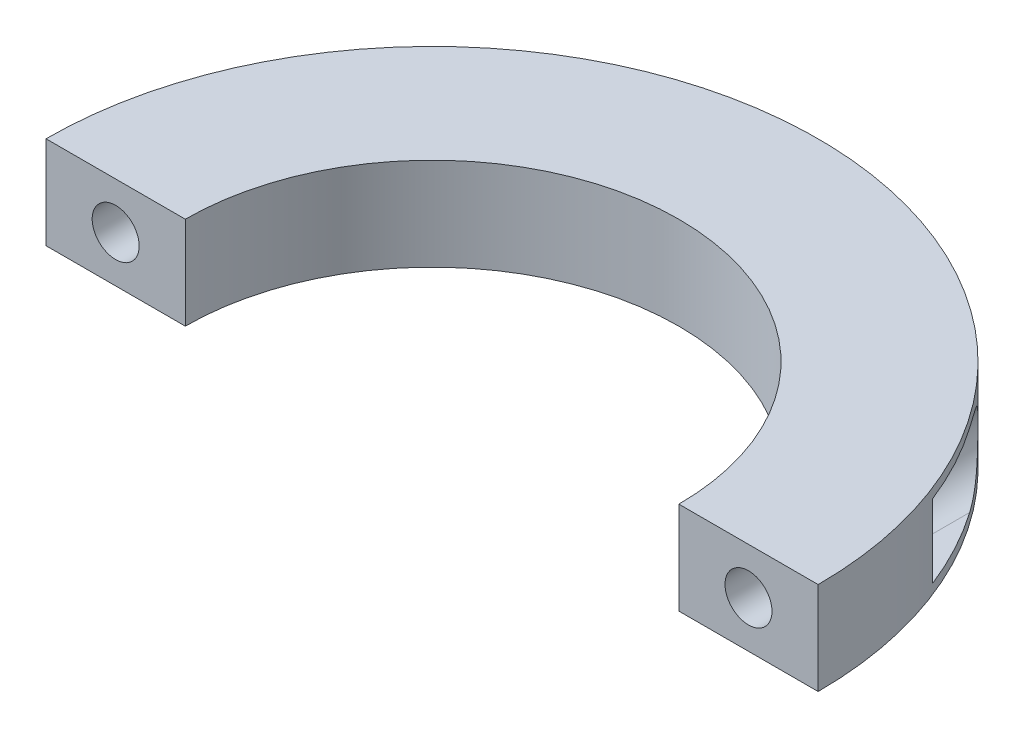
from build123d import *

# Parameters (mm, degrees)
BOSS_EXTRUDE1_DEPTH     = 7.2
SKETCH2_R               = 1.825
CUT_EXTRUDE1_DEPTH      = 47.2
CUT_EXTRUDE3_DEPTH      = 5
CUT_EXTRUDE3_DEPTH_BACK = 5.5
SKETCH3_R               = 2.85
CUT_EXTRUDE4_DEPTH      = 20


with BuildPart() as part:
    # Sketch1 → Boss-Extrude1 (new body)
    with BuildSketch(Plane(origin=(0, 0, 0), x_dir=(1, 0, 0), z_dir=(0, 1, 0))):
        with BuildLine():
            Line((-19.175, 0), (-30, 0))
            ThreePointArc((-30, 0), (0, 30), (30, 0))
            Line((30, 0), (19.175, 0))
            ThreePointArc((19.175, 0), (0, 19.175), (-19.175, 0))
        make_face()
    extrude(amount=BOSS_EXTRUDE1_DEPTH)

    # Sketch2 → Cut-Extrude1 (cut)
    with BuildSketch(Plane.XY):
        with Locations((-24.5875, 3.6)):
            Circle(SKETCH2_R)
        with Locations((24.5875, 3.6)):
            Circle(SKETCH2_R)
    extrude(amount=-CUT_EXTRUDE1_DEPTH, mode=Mode.SUBTRACT)

    # Sketch3 → Cut-Extrude3 (cut, two sides: drawn at the far end of the back side and taken through both)
    with BuildSketch(Plane(origin=(0, 0, -16.445655164), x_dir=(0, -1, 0), z_dir=(0, 0, -1)).offset(-CUT_EXTRUDE3_DEPTH_BACK)):
        with Locations(Location((-3.6, 24.5875, 0), (0, 0, 270))):
            Circle(SKETCH3_R)
        with Locations(Location((-3.6, -24.5875, 0), (0, 0, 270))):
            Circle(SKETCH3_R)
    extrude(amount=CUT_EXTRUDE3_DEPTH + CUT_EXTRUDE3_DEPTH_BACK, mode=Mode.SUBTRACT)

    # Sketch4 → Cut-Extrude4 (cut)
    with BuildSketch(Plane(origin=(0, 0, -10.945655164), x_dir=(1, 0, 0), z_dir=(0, 0, -1))):
        with BuildLine():
            Line((-30, -0.75), (-30, -6.45))
            Line((-30, -6.45), (-24.5875, -6.45))
            ThreePointArc((-24.5875, -6.45), (-21.7375, -3.6), (-24.5875, -0.75))
            Line((-24.5875, -0.75), (-30, -0.75))
        make_face()
        with BuildLine():
            Line((30, -0.75), (30, -6.45))
            Line((30, -6.45), (24.5875, -6.45))
            ThreePointArc((24.5875, -6.45), (21.7375, -3.6), (24.5875, -0.75))
            Line((24.5875, -0.75), (30, -0.75))
        make_face()
    extrude(amount=CUT_EXTRUDE4_DEPTH, mode=Mode.SUBTRACT)


solid = part.part
